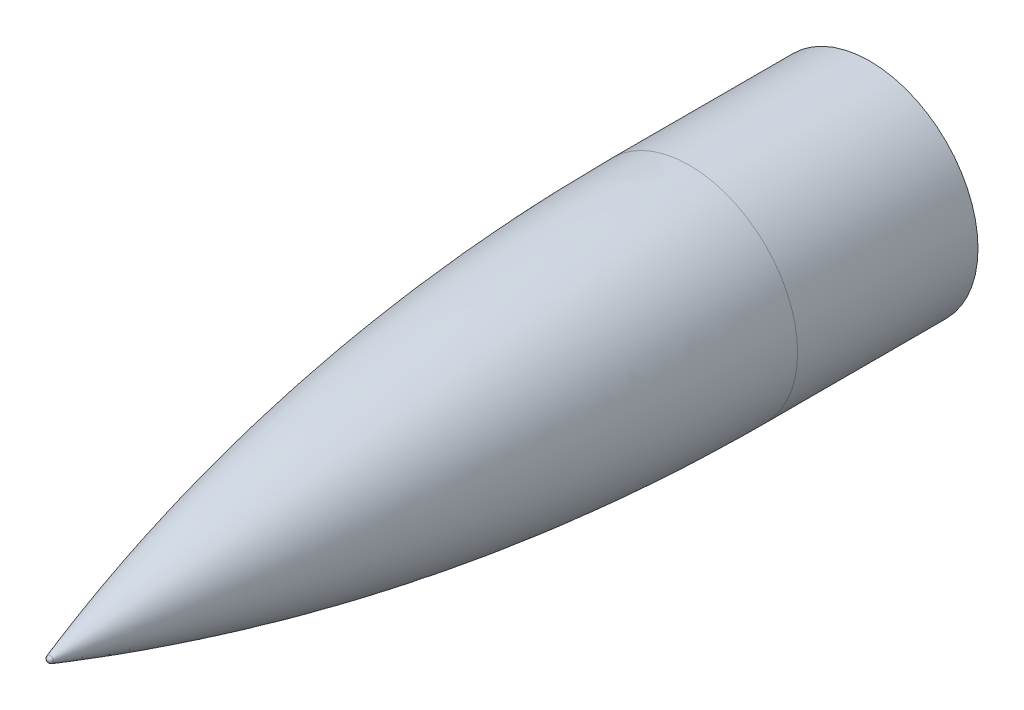
from build123d import *

# Parameters (mm, degrees)
SKETCH4_R           = 76.2
BOSS_EXTRUDE1_DEPTH = 127


with BuildPart() as part:
    # Sketch1 → Revolve1 (revolve)
    with BuildSketch(Plane(origin=(0, 0, 0), x_dir=(0, 0, -1), z_dir=(1, 0, 0))):
        with BuildLine():
            Line((457.200000001, 76.2), (457.200000001, 0))
            Line((457.200000001, 0), (5.352738095, 0))
            ThreePointArc((5.352738095, 0), (5.829778958, 1.481823066), (7.081714157, 2.407039711))
            add(Edge.make_bspline(
                [(7.081714157, 2.407039711), (7.699169806, 2.615084186), (8.957864154, 3.037971715), (11.328704763, 3.832243132), (13.328313339, 4.495965483), (15.606348626, 5.249855985), (17.808465472, 5.974522196), (20.414326972, 6.827025454), (23.376545495, 7.788665879), (26.349792173, 8.746733597), (29.336604217, 9.701803031), (32.344695283, 10.656339226), (35.369699382, 11.608736298), (38.414114302, 12.559700202), (42.221779975, 13.739614381), (46.795515938, 15.141818397), (52.137507588, 16.757537018), (58.251038118, 18.576465517), (64.372679562, 20.367695411), (70.502395777, 22.131220076), (81.243219169, 25.168810187), (96.626245012, 29.369297932), (125.960463947, 36.952978502), (169.482674092, 46.952697394), (219.611508639, 56.574925021), (270.09868984, 64.071772648), (308.124044325, 68.434503619), (331.939887808, 70.658632381), (344.653176693, 71.710648976), (354.192695832, 72.442121675), (363.736483149, 73.116034665), (374.876603063, 73.818284147), (386.022582597, 74.419697316), (395.579894234, 74.863133204), (403.546288387, 75.18460773), (409.920648506, 75.412948857), (415.498770123, 75.587509571), (420.281047098, 75.719103508), (424.265722803, 75.816744341), (427.056740621, 75.878781665), (429.445821312, 75.927448245), (431.824783137, 75.972184691), (434.17094241, 76.013080971), (436.932091663, 76.055520687), (440.014908088, 76.096964447), (443.195852679, 76.131501224), (446.212842429, 76.159130849), (449.518892815, 76.179853186), (452.273254042, 76.193668133), (455.224645405, 76.198848752), (456.548437389, 76.2), (457.200000001, 76.2)],
                knots=[0.08272397, 0.08272397, 0.08272397, 0.08272397, 0.08272397, 0.088412728, 0.094101487, 0.096945866, 0.099790245, 0.105479003, 0.111167761, 0.116856519, 0.122545278, 0.128234036, 0.134047973, 0.139861911, 0.145675848, 0.151489785, 0.16311766, 0.174745535, 0.18637341, 0.198001286, 0.209629161, 0.221257037, 0.267768539, 0.314280045, 0.430558798, 0.546837552, 0.639860554, 0.686372056, 0.709627807, 0.721255683, 0.732883558, 0.756139309, 0.779395059, 0.80265081, 0.814278685, 0.825906561, 0.837534436, 0.849162312, 0.854976249, 0.860790187, 0.866604125, 0.869511094, 0.872418063, 0.87810682, 0.883795577, 0.889484334, 0.895173092, 0.900861849, 0.906550606, 0.912239363, 0.917928121, 0.917928121, 0.917928121, 0.917928121, 0.917928121], degree=4))
        make_face()
    revolve(axis=Axis((0, 0, -480.06), (0, 0, 1)))

    # Sketch4 → Boss-Extrude1 (add)
    with BuildSketch(Plane(origin=(0, 0, -457.200000001), x_dir=(-1, 0, 0), z_dir=(0, 0, -1))):
        Circle(SKETCH4_R)
    extrude(amount=BOSS_EXTRUDE1_DEPTH)


solid = part.part
